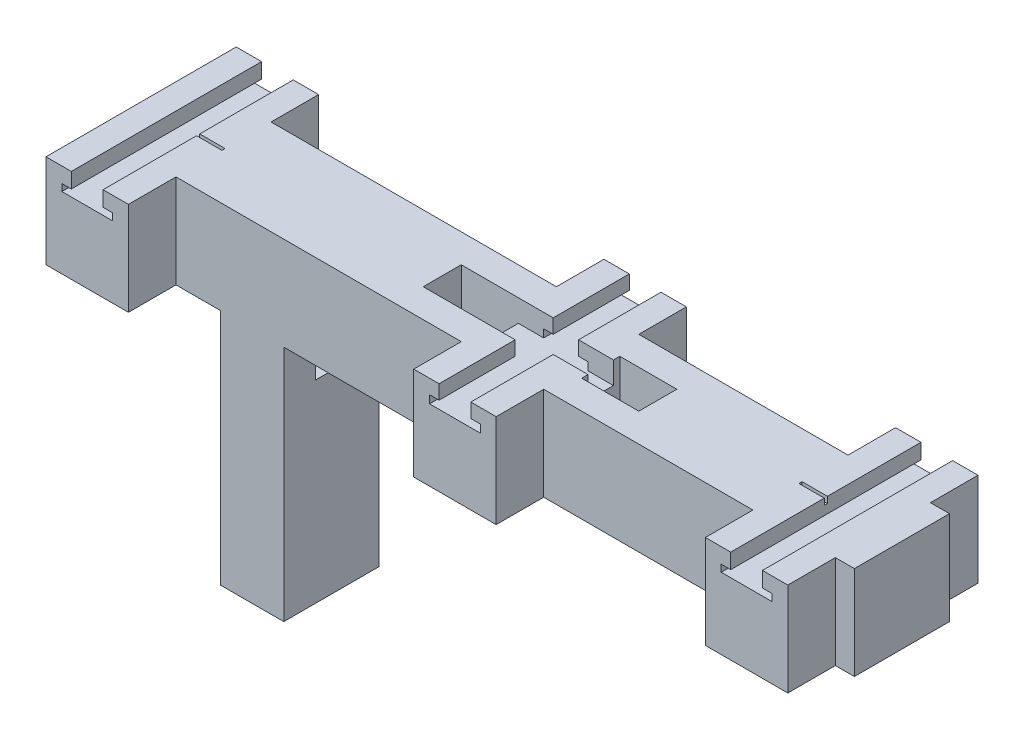
from build123d import *

# Parameters (mm, degrees)
BOSS_EXTRUDE1_DEPTH      = 15
BOSS_EXTRUDE1_DEPTH_BACK = 22.5
SKETCH2_W                = 240
SKETCH2_H                = 40
CUT_EXTRUDE1_REACH       = 130.477
SKETCH3_W                = 16
SKETCH3_H                = 2.2
SKETCH3_H_2              = 2.5
SKETCH5_W                = 240
SKETCH5_H                = 40
CUT_EXTRUDE2_DEPTH       = 8
SKETCH6_W                = 20
SKETCH6_H                = 30
BOSS_EXTRUDE2_DEPTH      = 75
CUT_EXTRUDE3_REACH       = 161.707
SKETCH8_W                = 10
SKETCH8_H                = 4.8
SKETCH8_H_2              = 4.5
SKETCH9_R                = 2.1
CUT_EXTRUDE4_DEPTH       = 4.4
SKETCH11_R               = 1.55
CUT_EXTRUDE5_DEPTH       = 11
SKETCH10_R               = 1.55
CUT_EXTRUDE6_DEPTH       = 11
SKETCH12_R               = 2.1
CUT_EXTRUDE7_DEPTH       = 4.4
SKETCH13_R               = 1.65
CUT_EXTRUDE8_DEPTH       = 11
SKETCH14_W               = 18
SKETCH14_H               = 12
CUT_EXTRUDE9_DEPTH       = 29.5
SKETCH15_W               = 10
SKETCH15_H               = 14
CUT_EXTRUDE10_DEPTH      = 20
BOSS_EXTRUDE3_DEPTH      = 10
BOSS_EXTRUDE3_DEPTH_BACK = 50
CUT_EXTRUDE11_REACH      = 163.927
SKETCH18_W               = 89.999903017
SKETCH18_H               = 5
SKETCH18_W_2             = 6.000219265
SKETCH18_W_3             = 65.999877718
SKETCH20_W               = 11
SKETCH20_H               = 12
CUT_EXTRUDE12_DEPTH      = 7
SKETCH21_W               = 8
SKETCH21_H               = 0.5
CUT_EXTRUDE13_DEPTH      = 2
SKETCH22_W               = 8
SKETCH22_H               = 1
CUT_EXTRUDE14_DEPTH      = 2
CUT_EXTRUDE15_REACH      = 163.927
SKETCH23_W               = 11
SKETCH23_H               = 8


with BuildPart() as part:
    # Sketch2 → Boss-Extrude1 (new, two sides: drawn at the far end of the back side and taken through both)
    with BuildSketch(Plane(origin=(0, 0, 0), x_dir=(1, 0, 0), z_dir=(0, 1, 0)).offset(-BOSS_EXTRUDE1_DEPTH_BACK)):
        Rectangle(SKETCH2_W, SKETCH2_H)
    extrude(amount=BOSS_EXTRUDE1_DEPTH + BOSS_EXTRUDE1_DEPTH_BACK)

    # Sketch3 → Cut-Extrude1 (cut, up to next)
    with BuildSketch(Plane.XY.offset(20), mode=Mode.PRIVATE) as cut_extrude1_sk1:
        with Locations((-107, 1.1)):
            Rectangle(SKETCH3_W, SKETCH3_H)
    cut_extrude1_tool1 = extrude(cut_extrude1_sk1.sketch, amount=-CUT_EXTRUDE1_REACH, mode=Mode.PRIVATE) & part.part
    # Sketch3 → Cut-Extrude1 (cut, up to next)
    with BuildSketch(Plane.XY.offset(20), mode=Mode.PRIVATE) as cut_extrude1_sk2:
        with Locations((8.999903017, 1.25)):
            Rectangle(SKETCH3_W, SKETCH3_H_2)
    cut_extrude1_tool2 = extrude(cut_extrude1_sk2.sketch, amount=-CUT_EXTRUDE1_REACH, mode=Mode.PRIVATE) & part.part
    # Sketch3 → Cut-Extrude1 (cut, up to next)
    with BuildSketch(Plane.XY.offset(20), mode=Mode.PRIVATE) as cut_extrude1_sk3:
        with Locations((100.999780735, 1.1)):
            Rectangle(SKETCH3_W, SKETCH3_H)
    cut_extrude1_tool3 = extrude(cut_extrude1_sk3.sketch, amount=-CUT_EXTRUDE1_REACH, mode=Mode.PRIVATE) & part.part
    add(cut_extrude1_tool1.solids().sort_by_distance((-107, 1.1, 20))[0], mode=Mode.SUBTRACT)
    add(cut_extrude1_tool2.solids().sort_by_distance((8.999903, 1.25, 20))[0], mode=Mode.SUBTRACT)
    add(cut_extrude1_tool3.solids().sort_by_distance((100.999781, 1.1, 20))[0], mode=Mode.SUBTRACT)

    # Sketch5 → Cut-Extrude2 (cut)
    with BuildSketch(Plane(origin=(0, 15, 0), x_dir=(1, 0, 0), z_dir=(0, 1, 0))):
        Rectangle(SKETCH5_W, SKETCH5_H)
    extrude(amount=-CUT_EXTRUDE2_DEPTH, mode=Mode.SUBTRACT)

    # Sketch6 → Boss-Extrude2 (add)
    with BuildSketch(Plane.XZ.offset(22.5)):
        with Locations((-70, 0)):
            Rectangle(SKETCH6_W, SKETCH6_H)
    extrude(amount=BOSS_EXTRUDE2_DEPTH)

    # Sketch8 → Cut-Extrude3 (cut, up to next)
    with BuildSketch(Plane.XY.offset(20), mode=Mode.PRIVATE) as cut_extrude3_sk1:
        with Locations((-107, 4.6)):
            Rectangle(SKETCH8_W, SKETCH8_H)
    cut_extrude3_tool1 = extrude(cut_extrude3_sk1.sketch, amount=-CUT_EXTRUDE3_REACH, mode=Mode.PRIVATE) & part.part
    # Sketch8 → Cut-Extrude3 (cut, up to next)
    with BuildSketch(Plane.XY.offset(20), mode=Mode.PRIVATE) as cut_extrude3_sk2:
        with Locations((8.999903017, 4.75)):
            Rectangle(SKETCH8_W, SKETCH8_H_2)
    cut_extrude3_tool2 = extrude(cut_extrude3_sk2.sketch, amount=-CUT_EXTRUDE3_REACH, mode=Mode.PRIVATE) & part.part
    # Sketch8 → Cut-Extrude3 (cut, up to next)
    with BuildSketch(Plane.XY.offset(20), mode=Mode.PRIVATE) as cut_extrude3_sk3:
        with Locations((100.999780735, 4.6)):
            Rectangle(SKETCH8_W, SKETCH8_H)
    cut_extrude3_tool3 = extrude(cut_extrude3_sk3.sketch, amount=-CUT_EXTRUDE3_REACH, mode=Mode.PRIVATE) & part.part
    add(cut_extrude3_tool1.solids().sort_by_distance((-107, 4.6, 20))[0], mode=Mode.SUBTRACT)
    add(cut_extrude3_tool2.solids().sort_by_distance((8.999903, 4.75, 20))[0], mode=Mode.SUBTRACT)
    add(cut_extrude3_tool3.solids().sort_by_distance((100.999781, 4.6, 20))[0], mode=Mode.SUBTRACT)

    # Sketch9 → Cut-Extrude4 (cut)
    with BuildSketch(Plane(origin=(0, 0, 0), x_dir=(1, 0, 0), z_dir=(0, 1, 0))):
        with Locations(Location((-107, 0, 0), (0, 0, 270))):
            Circle(SKETCH9_R)
        with Locations(Location((100.999780735, 0, 0), (0, 0, 270))):
            Circle(SKETCH9_R)
    extrude(amount=-CUT_EXTRUDE4_DEPTH, mode=Mode.SUBTRACT)

    # Sketch11 → Cut-Extrude5 (cut)
    with BuildSketch(Plane(origin=(0, -4.4, 0), x_dir=(1, 0, 0), z_dir=(0, 1, 0))):
        with Locations(Location((100.999780735, 0, 0), (0, 0, 270))):
            Circle(SKETCH11_R)
    extrude(amount=-CUT_EXTRUDE5_DEPTH, mode=Mode.SUBTRACT)

    # Sketch10 → Cut-Extrude6 (cut)
    with BuildSketch(Plane(origin=(0, -4.4, 0), x_dir=(1, 0, 0), z_dir=(0, 1, 0))):
        with Locations(Location((-107, 0, 0), (0, 0, 270))):
            Circle(SKETCH10_R)
    extrude(amount=-CUT_EXTRUDE6_DEPTH, mode=Mode.SUBTRACT)

    # Sketch12 → Cut-Extrude7 (cut)
    with BuildSketch(Plane(origin=(0, 0, 0), x_dir=(1, 0, 0), z_dir=(0, 1, 0))):
        with Locations(Location((10.715225152, -11.813940745, 0), (0, 0, 270))):
            Circle(SKETCH12_R)
        with Locations(Location((10.75, 12, 0), (0, 0, 270))):
            Circle(SKETCH12_R)
    extrude(amount=-CUT_EXTRUDE7_DEPTH, mode=Mode.SUBTRACT)

    # Sketch13 → Cut-Extrude8 (cut)
    with BuildSketch(Plane(origin=(0, -4.4, 0), x_dir=(1, 0, 0), z_dir=(0, 1, 0))):
        with Locations(Location((10.715225152, -11.813940745, 0), (0, 0, 270))):
            Circle(SKETCH13_R)
        with Locations(Location((10.75, 12, 0), (0, 0, 270))):
            Circle(SKETCH13_R)
    extrude(amount=-CUT_EXTRUDE8_DEPTH, mode=Mode.SUBTRACT)

    # Sketch14 → Cut-Extrude9 (cut)
    with BuildSketch(Plane(origin=(0, 7, 0), x_dir=(1, 0, 0), z_dir=(0, 1, 0))):
        with Locations((-16.000096983, 0)):
            Rectangle(SKETCH14_W, SKETCH14_H)
        with Locations((33.999903017, 0)):
            Rectangle(SKETCH14_W, SKETCH14_H)
    extrude(amount=-CUT_EXTRUDE9_DEPTH, mode=Mode.SUBTRACT)

    # Sketch15 → Cut-Extrude10 (cut)
    with BuildSketch(Plane.ZY.offset(80)):
        with Locations((0, -29.5)):
            Rectangle(SKETCH15_W, SKETCH15_H)
    extrude(amount=-CUT_EXTRUDE10_DEPTH, mode=Mode.SUBTRACT)

    # Sketch17 → Boss-Extrude3 (add, two sides: drawn at the far end of the back side and taken through both)
    with BuildSketch(Plane.XY.offset(20).offset(-BOSS_EXTRUDE3_DEPTH_BACK)):
        Polygon((-120, 7), (-120, -22.5), (-94, -22.5), (-94, 7), (-102, 7), (-102, 2.2), (-99, 2.2), (-99, 0), (-115, 0), (-115, 2.2), (-112, 2.2), (-112, 7), align=None)
        Polygon((21.999903017, 7), (21.999903017, -22.5), (-4.000096983, -22.5), (-4.000096983, 7), (3.999903017, 7), (3.999903017, 2.5), (0.999903017, 2.5), (0.999903017, 0), (16.999903017, 0), (16.999903017, 2.5), (13.999903017, 2.5), (13.999903017, 7), align=None)
        Polygon((87.999780735, 7), (87.999780735, -22.5), (113.999780735, -22.5), (113.999780735, 7), (105.999780735, 7), (105.999780735, 2.2), (108.999780735, 2.2), (108.999780735, 0), (92.999780735, 0), (92.999780735, 2.2), (95.999780735, 2.2), (95.999780735, 7), align=None)
    extrude(amount=BOSS_EXTRUDE3_DEPTH + BOSS_EXTRUDE3_DEPTH_BACK)

    # Sketch18 → Cut-Extrude11 (cut, up to next)
    with BuildSketch(Plane(origin=(0, 7, 0), x_dir=(1, 0, 0), z_dir=(0, 1, 0)), mode=Mode.PRIVATE) as cut_extrude11_sk1:
        with Locations((-49.000048492, -17.5)):
            Rectangle(SKETCH18_W, SKETCH18_H)
    cut_extrude11_tool1 = extrude(cut_extrude11_sk1.sketch, amount=-CUT_EXTRUDE11_REACH, mode=Mode.PRIVATE) & part.part
    # Sketch18 → Cut-Extrude11 (cut, up to next)
    with BuildSketch(Plane(origin=(0, 7, 0), x_dir=(1, 0, 0), z_dir=(0, 1, 0)), mode=Mode.PRIVATE) as cut_extrude11_sk2:
        with Locations((116.999890368, -17.5)):
            Rectangle(SKETCH18_W_2, SKETCH18_H)
    cut_extrude11_tool2 = extrude(cut_extrude11_sk2.sketch, amount=-CUT_EXTRUDE11_REACH, mode=Mode.PRIVATE) & part.part
    # Sketch18 → Cut-Extrude11 (cut, up to next)
    with BuildSketch(Plane(origin=(0, 7, 0), x_dir=(1, 0, 0), z_dir=(0, 1, 0)), mode=Mode.PRIVATE) as cut_extrude11_sk3:
        with Locations((-49.000048492, 17.5)):
            Rectangle(SKETCH18_W, SKETCH18_H)
    cut_extrude11_tool3 = extrude(cut_extrude11_sk3.sketch, amount=-CUT_EXTRUDE11_REACH, mode=Mode.PRIVATE) & part.part
    # Sketch18 → Cut-Extrude11 (cut, up to next)
    with BuildSketch(Plane(origin=(0, 7, 0), x_dir=(1, 0, 0), z_dir=(0, 1, 0)), mode=Mode.PRIVATE) as cut_extrude11_sk4:
        with Locations((54.999841876, -17.5)):
            Rectangle(SKETCH18_W_3, SKETCH18_H)
    cut_extrude11_tool4 = extrude(cut_extrude11_sk4.sketch, amount=-CUT_EXTRUDE11_REACH, mode=Mode.PRIVATE) & part.part
    # Sketch18 → Cut-Extrude11 (cut, up to next)
    with BuildSketch(Plane(origin=(0, 7, 0), x_dir=(1, 0, 0), z_dir=(0, 1, 0)), mode=Mode.PRIVATE) as cut_extrude11_sk5:
        with Locations((116.999890368, 17.5)):
            Rectangle(SKETCH18_W_2, SKETCH18_H)
    cut_extrude11_tool5 = extrude(cut_extrude11_sk5.sketch, amount=-CUT_EXTRUDE11_REACH, mode=Mode.PRIVATE) & part.part
    # Sketch18 → Cut-Extrude11 (cut, up to next)
    with BuildSketch(Plane(origin=(0, 7, 0), x_dir=(1, 0, 0), z_dir=(0, 1, 0)), mode=Mode.PRIVATE) as cut_extrude11_sk6:
        with Locations((54.999841876, 17.5)):
            Rectangle(SKETCH18_W_3, SKETCH18_H)
    cut_extrude11_tool6 = extrude(cut_extrude11_sk6.sketch, amount=-CUT_EXTRUDE11_REACH, mode=Mode.PRIVATE) & part.part
    add(cut_extrude11_tool1.solids().sort_by_distance((-49.000048, 7, 17.5))[0], mode=Mode.SUBTRACT)
    add(cut_extrude11_tool2.solids().sort_by_distance((116.99989, 7, 17.5))[0], mode=Mode.SUBTRACT)
    add(cut_extrude11_tool3.solids().sort_by_distance((-49.000048, 7, -17.5))[0], mode=Mode.SUBTRACT)
    add(cut_extrude11_tool4.solids().sort_by_distance((54.999842, 7, 17.5))[0], mode=Mode.SUBTRACT)
    add(cut_extrude11_tool5.solids().sort_by_distance((116.99989, 7, -17.5))[0], mode=Mode.SUBTRACT)
    add(cut_extrude11_tool6.solids().sort_by_distance((54.999842, 7, -17.5))[0], mode=Mode.SUBTRACT)

    # Sketch20 → Cut-Extrude12 (cut)
    with BuildSketch(Plane(origin=(0, 7, 0), x_dir=(1, 0, 0), z_dir=(0, 1, 0))):
        with Locations((-1.500096983, 0)):
            Rectangle(SKETCH20_W, SKETCH20_H)
    extrude(amount=-CUT_EXTRUDE12_DEPTH, mode=Mode.SUBTRACT)

    # Sketch21 → Cut-Extrude13 (cut)
    with BuildSketch(Plane(origin=(0, 7, 0), x_dir=(1, 0, 0), z_dir=(0, 1, 0))):
        with Locations((-98, -0.25)):
            Rectangle(SKETCH21_W, SKETCH21_H)
        with Locations((-98, 0.25)):
            Rectangle(SKETCH21_W, SKETCH21_H)
    extrude(amount=-CUT_EXTRUDE13_DEPTH, mode=Mode.SUBTRACT)

    # Sketch22 → Cut-Extrude14 (cut)
    with BuildSketch(Plane(origin=(0, 7, 0), x_dir=(1, 0, 0), z_dir=(0, 1, 0))):
        with Locations((91.999780735, 0)):
            Rectangle(SKETCH22_W, SKETCH22_H)
    extrude(amount=-CUT_EXTRUDE14_DEPTH, mode=Mode.SUBTRACT)

    # Cut-Extrude15: up to this face of the body (flat: up to its plane)
    cut_extrude15_end = Plane(part.part.faces().sort_by_distance((7.908993926, 0, 0))[0])
    # Sketch23 → Cut-Extrude15 (cut, up to the picked face)
    with BuildSketch(Plane(origin=(0, 7, 0), x_dir=(1, 0, 0), z_dir=(0, 1, 0)), mode=Mode.PRIVATE) as cut_extrude15_sk1:
        with Locations((19.499903017, 0)):
            Rectangle(SKETCH23_W, SKETCH23_H)
    cut_extrude15_tool1 = split(extrude(cut_extrude15_sk1.sketch, amount=-CUT_EXTRUDE15_REACH, mode=Mode.PRIVATE), bisect_by=cut_extrude15_end, keep=Keep.BOTH, mode=Mode.PRIVATE)
    add(cut_extrude15_tool1.solids().sort_by(Axis((19.499903, 7, 0), (0, -1, 0)))[0], mode=Mode.SUBTRACT)


solid = part.part
